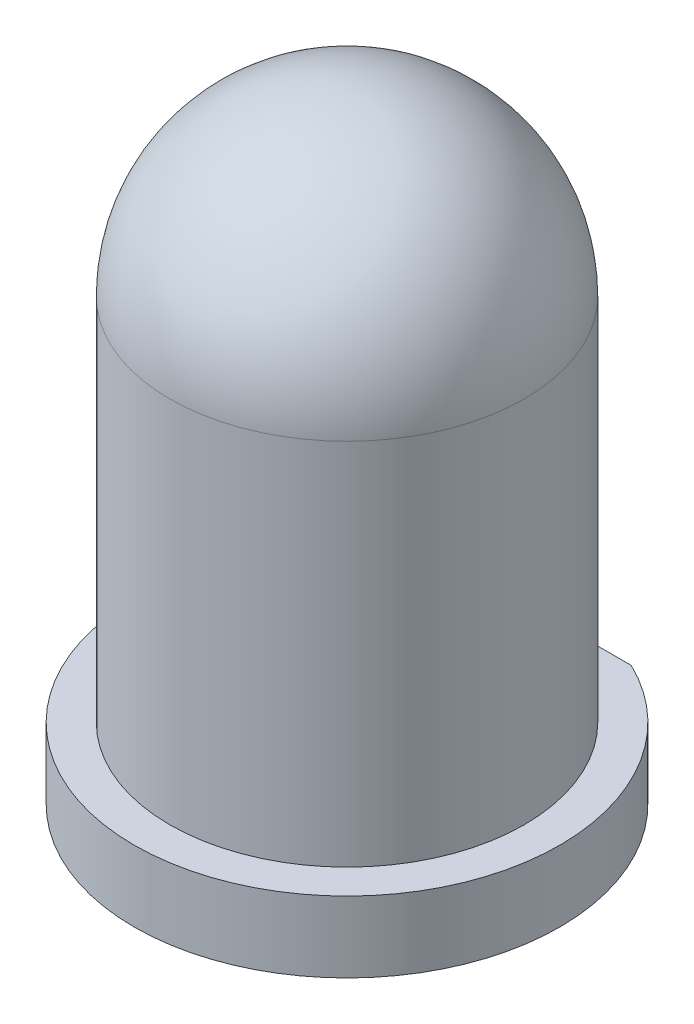
from build123d import *

# Parameters (mm, degrees)
SKETCH3_W          = 0.3
SKETCH3_H          = 1
CUT_EXTRUDE1_DEPTH = 10


with BuildPart() as part:
    # Sketch1 → Revolve1 (revolve)
    with BuildSketch(Plane.XY, mode=Mode.PRIVATE) as revolve1_sk:
        with BuildLine():
            Line((-3, -0.5), (0, -0.5))
            Line((0, -0.5), (0, 8.2))
            ThreePointArc((0, 8.2), (-1.767766953, 7.467766953), (-2.5, 5.7))
            Line((-2.5, 5.7), (-2.5, 0.5))
            Line((-2.5, 0.5), (-3, 0.5))
            Line((-3, 0.5), (-3, -0.5))
        make_face()
    revolve(revolve1_sk.sketch.rotate(Axis((0, -0.5, 0), (0, 1, 0)), 270), axis=Axis((0, -0.5, 0), (0, 1, 0)))

    # Sketch3 → Cut-Extrude1 (cut)
    with BuildSketch(Plane(origin=(3, 0, 0), x_dir=(0, 0, -1), z_dir=(1, 0, 0))):
        with Locations((2.85, 0)):
            Rectangle(SKETCH3_W, SKETCH3_H)
    extrude(amount=-CUT_EXTRUDE1_DEPTH, mode=Mode.SUBTRACT)


solid = part.part
